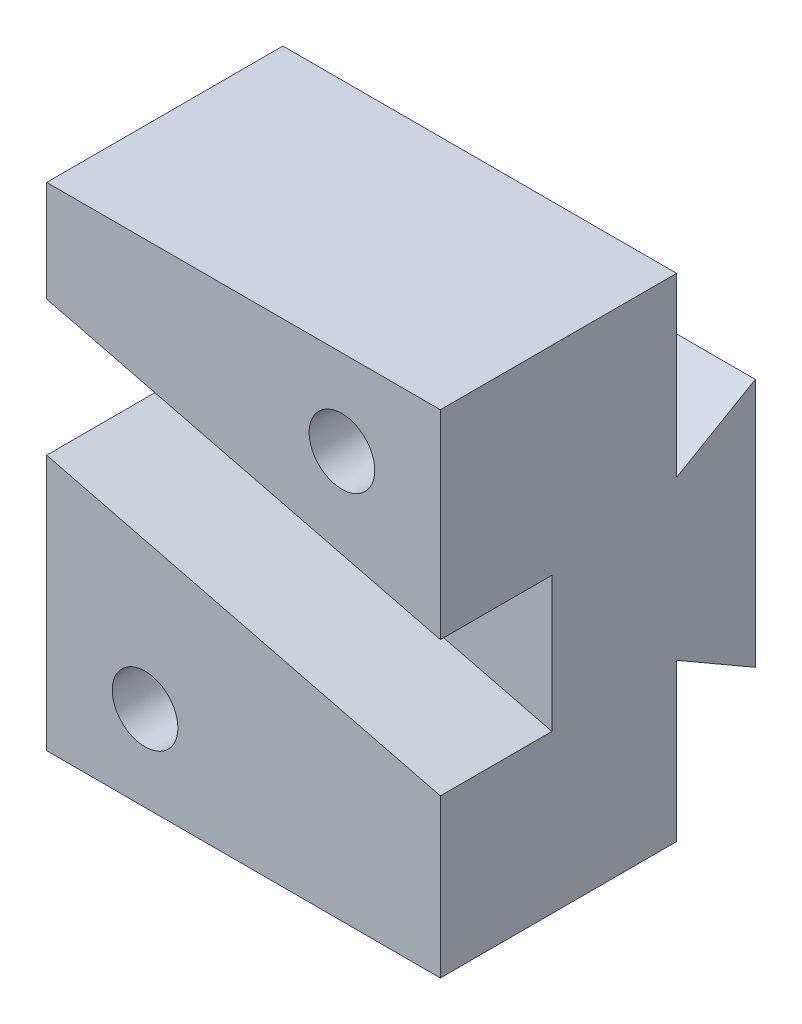
from build123d import *

# Parameters (mm, degrees)
BOSS_EXTRUDE1_DEPTH = 60
CUT_EXTRUDE1_DEPTH  = 17
CUT_EXTRUDE2_REACH  = 109.373
SKETCH4_R           = 5


with BuildPart() as part:
    # Sketch1 → Boss-Extrude1 (new body)
    with BuildSketch(Plane(origin=(0, 0, 0), x_dir=(0, 0, -1), z_dir=(1, 0, 0))):
        Polygon((-36, 75), (0, 75), (0, 48.07179677), (12, 55), (12, 17), (0, 23.92820323), (0, 0), (-36, 0), align=None)
    extrude(amount=BOSS_EXTRUDE1_DEPTH)

    # Sketch2 → Cut-Extrude1 (cut)
    with BuildSketch(Plane.XY.offset(36)):
        Polygon((0, 59.612272587), (60, 44.652592416), (60, 24.040319829), (0, 39), align=None)
    extrude(amount=-CUT_EXTRUDE1_DEPTH, mode=Mode.SUBTRACT)

    # Sketch4 → Cut-Extrude2 (cut, up to next)
    with BuildSketch(Plane.XY.offset(36), mode=Mode.PRIVATE) as cut_extrude2_sk1:
        with Locations((45, 62)):
            Circle(SKETCH4_R)
    cut_extrude2_tool1 = extrude(cut_extrude2_sk1.sketch, amount=-CUT_EXTRUDE2_REACH, mode=Mode.PRIVATE) & part.part
    # Sketch4 → Cut-Extrude2 (cut, up to next)
    with BuildSketch(Plane.XY.offset(36), mode=Mode.PRIVATE) as cut_extrude2_sk2:
        with Locations((15, 13)):
            Circle(SKETCH4_R)
    cut_extrude2_tool2 = extrude(cut_extrude2_sk2.sketch, amount=-CUT_EXTRUDE2_REACH, mode=Mode.PRIVATE) & part.part
    add(cut_extrude2_tool1.solids().sort_by_distance((45, 62, 36))[0], mode=Mode.SUBTRACT)
    add(cut_extrude2_tool2.solids().sort_by_distance((15, 13, 36))[0], mode=Mode.SUBTRACT)


solid = part.part
